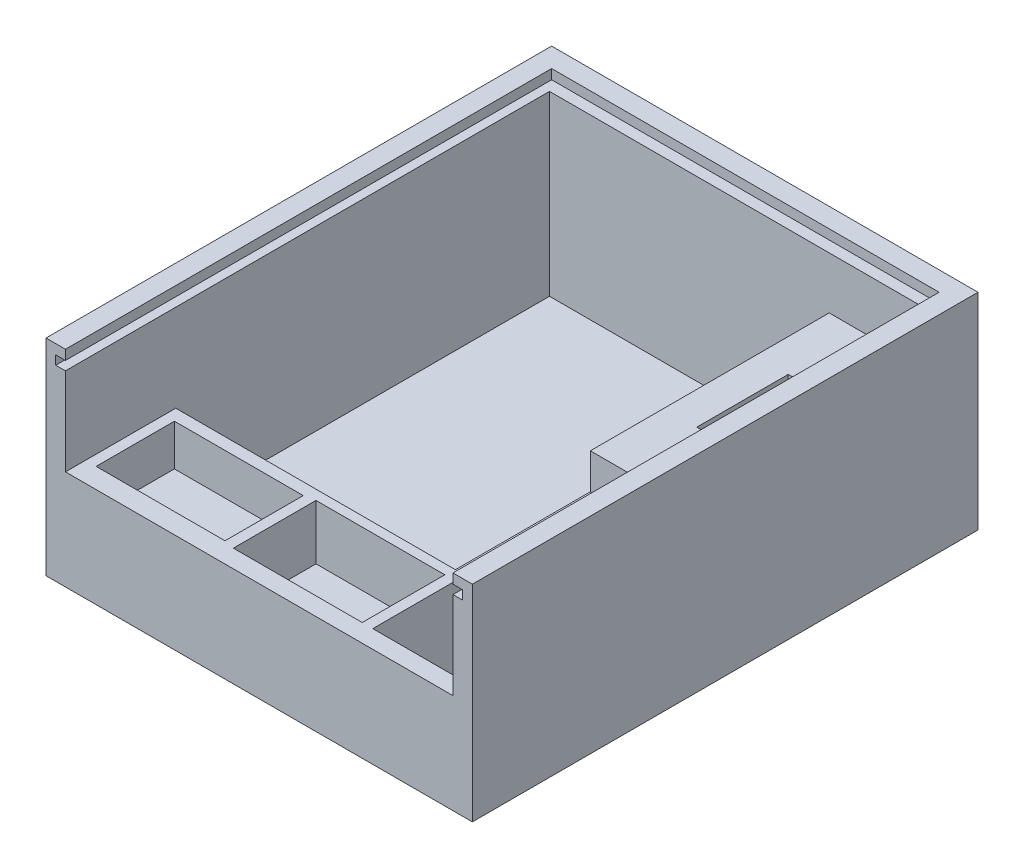
from build123d import *

# Parameters (mm, degrees)
BOSS_EXTRUDE1_DEPTH = 36.5
BOSS_EXTRUDE2_DEPTH = 40.35
SKETCH1_4_W         = 22.175
SKETCH1_4_H         = 49.125448028
SKETCH1_4_W_2       = 8.7
SKETCH1_4_H_2       = 18.8
BOSS_EXTRUDE3_DEPTH = 25.8
SKETCH1_5_W         = 8.7
SKETCH1_5_H         = 18.8
BOSS_EXTRUDE4_DEPTH = 20.8
SKETCH1_6_W         = 26.5
SKETCH1_6_H         = 17
BOSS_EXTRUDE5_DEPTH = 7.2
SKETCH1_7_W         = 26.5
SKETCH1_7_H         = 16.1
BOSS_EXTRUDE6_DEPTH = 10
SKETCH1_8_W         = 18
SKETCH1_8_H         = 43.5
SKETCH1_8_W_2       = 26.5
SKETCH1_8_H_2       = 16.1
SKETCH1_8_H_3       = 17
BOSS_EXTRUDE7_DEPTH = 18.5
SKETCH1_9_W         = 87.7
SKETCH1_9_H         = 104
BOSS_EXTRUDE8_DEPTH = 2
BOSS_EXTRUDE9_DEPTH = 2


with BuildPart() as part:
    # Sketch1 → Boss-Extrude1 (new body)
    with BuildSketch(Plane(origin=(0, 0, 0), x_dir=(1, 0, 0), z_dir=(0, 1, 0))):
        Polygon((-41.85, -51), (-39.85, -51), (-39.85, -48.562724014), (-39.85, -28.312724014), (-39.85, 48.562724014), (17.675, 48.562724014), (39.85, 48.562724014), (39.85, -0.562724014), (39.85, -48.562724014), (39.85, -51), (41.85, -51), (41.85, 51), (-41.85, 51), align=None)
    extrude(amount=BOSS_EXTRUDE1_DEPTH)

    # Sketch1<3> → Boss-Extrude2 (add)
    with BuildSketch(Plane(origin=(0, 0, 0), x_dir=(1, 0, 0), z_dir=(0, 1, 0))):
        Polygon((-43.85, -51), (-41.85, -51), (-41.85, 51), (41.85, 51), (41.85, -51), (43.85, -51), (43.85, 53), (-43.85, 53), align=None)
    extrude(amount=BOSS_EXTRUDE2_DEPTH)

    # Sketch1<4> → Boss-Extrude3 (add)
    with BuildSketch(Plane(origin=(0, 0, 0), x_dir=(1, 0, 0), z_dir=(0, 1, 0))):
        with Locations((28.7625, 24)):
            Rectangle(SKETCH1_4_W, SKETCH1_4_H)
        with Locations((28.7625, 24)):
            Rectangle(SKETCH1_4_W_2, SKETCH1_4_H_2, mode=Mode.SUBTRACT)
    extrude(amount=BOSS_EXTRUDE3_DEPTH)

    # Sketch1<5> → Boss-Extrude4 (add)
    with BuildSketch(Plane(origin=(0, 0, 0), x_dir=(1, 0, 0), z_dir=(0, 1, 0))):
        with Locations((28.7625, 24)):
            Rectangle(SKETCH1_5_W, SKETCH1_5_H)
    extrude(amount=BOSS_EXTRUDE4_DEPTH)



with BuildPart() as body_2:
    # Sketch1<6> → Boss-Extrude5 (new body)
    with BuildSketch(Plane(origin=(0, 0, 0), x_dir=(1, 0, 0), z_dir=(0, 1, 0))):
        with Locations((4.25, -38.812724014)):
            Rectangle(SKETCH1_6_W, SKETCH1_6_H)
    extrude(amount=BOSS_EXTRUDE5_DEPTH)


with BuildPart() as body_3:
    # Sketch1<7> → Boss-Extrude6 (new body)
    with BuildSketch(Plane(origin=(0, 0, 0), x_dir=(1, 0, 0), z_dir=(0, 1, 0))):
        with Locations((-24.425, -38.812724014)):
            Rectangle(SKETCH1_7_W, SKETCH1_7_H)
    extrude(amount=BOSS_EXTRUDE6_DEPTH)


with BuildPart() as part_1:
    add(part.part)

    add(body_2.part)  # Boss-Extrude7 merges body 2

    add(body_3.part)  # Boss-Extrude7 merges body 3
    # Sketch1<8> → Boss-Extrude7 (add)
    with BuildSketch(Plane(origin=(0, 0, 0), x_dir=(1, 0, 0), z_dir=(0, 1, 0))):
        Polygon((-39.85, -51), (39.85, -51), (39.85, -0.562724014), (17.675, -0.562724014), (17.675, -28.312724014), (-39.85, -28.312724014), align=None)
        with Locations((28.675, -25.562724014)):
            Rectangle(SKETCH1_8_W, SKETCH1_8_H, mode=Mode.SUBTRACT)
        with Locations((-24.425, -38.812724014)):
            Rectangle(SKETCH1_8_W_2, SKETCH1_8_H_2, mode=Mode.SUBTRACT)
        with Locations((4.25, -38.812724014)):
            Rectangle(SKETCH1_8_W_2, SKETCH1_8_H_3, mode=Mode.SUBTRACT)
    extrude(amount=BOSS_EXTRUDE7_DEPTH)

    # Sketch1<9> → Boss-Extrude8 (add)
    with BuildSketch(Plane(origin=(0, 0, 0), x_dir=(1, 0, 0), z_dir=(0, 1, 0))):
        with Locations((0, 1)):
            Rectangle(SKETCH1_9_W, SKETCH1_9_H)
    extrude(amount=-BOSS_EXTRUDE8_DEPTH)

    # Sketch2 → Boss-Extrude9 (add)
    with BuildSketch(Plane(origin=(0, 40.35, 0), x_dir=(1, 0, 0), z_dir=(0, 1, 0))):
        Polygon((-41.85, -51), (-41.85, 51), (41.85, 51), (41.85, -51), (39.85, -51), (39.85, 49), (-39.85, 49), (-39.85, -51), align=None)
    extrude(amount=-BOSS_EXTRUDE9_DEPTH)


solid = part_1.part
